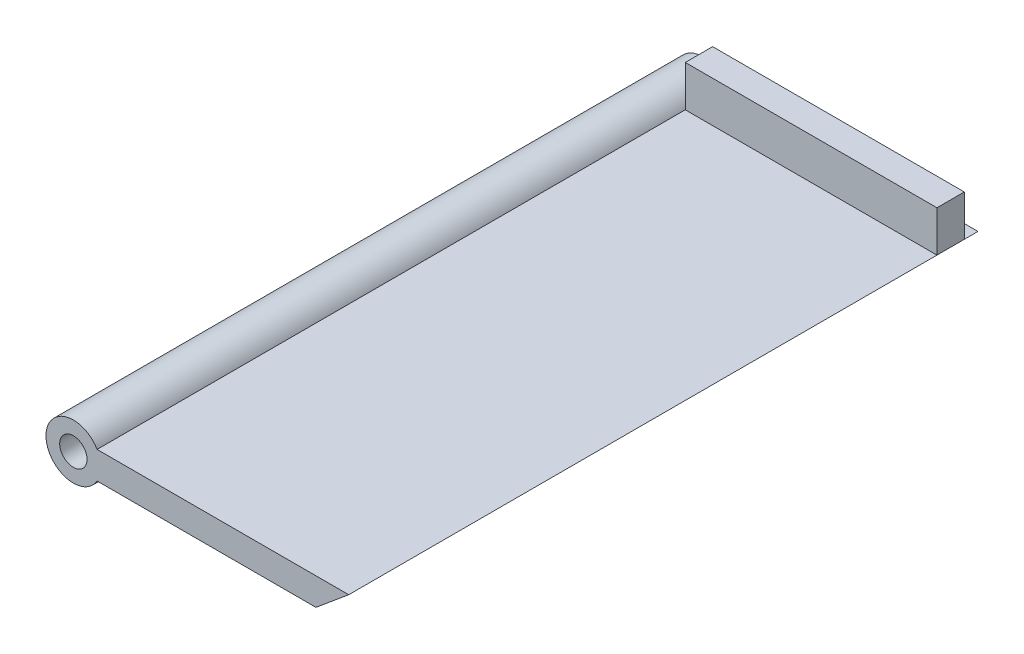
from build123d import *

# Parameters (mm, degrees)
SKETCH1_R           = 3.175
BOSS_EXTRUDE1_DEPTH = 146.05
BOSS_EXTRUDE2_DEPTH = 3.175
SKETCH3_W           = 58.42
SKETCH3_H           = 9.525
BOSS_EXTRUDE3_DEPTH = 3.175


with BuildPart() as part:
    # Sketch1 → Boss-Extrude1 (new body)
    with BuildSketch(Plane.XY):
        with BuildLine():
            Line((40.420068278, 3.055455197), (32.800068278, -3.294544803))
            Line((32.800068278, -3.294544803), (-17.999931722, -3.294544803))
            ThreePointArc((-17.999931722, -3.294544803), (-29.849193037, -0.119544803), (-17.999931722, 3.055455197))
            Line((-17.999931722, 3.055455197), (40.420068278, 3.055455197))
        make_face()
        with Locations((-23.499193037, -0.119544803)):
            Circle(SKETCH1_R, mode=Mode.SUBTRACT)
    extrude(amount=BOSS_EXTRUDE1_DEPTH)

    # Sketch2 → Boss-Extrude2 (add)
    with BuildSketch(Plane.XY.offset(3.175)):
        Polygon((-17.999931722, 3.055455197), (-14.824931722, 3.055455197), (-14.824931722, 9.405455197), (37.245068278, 9.405455197), (37.245068278, 3.055455197), (40.420068278, 3.055455197), (40.420068278, 12.580455197), (-17.999931722, 12.580455197), align=None)
    extrude(amount=BOSS_EXTRUDE2_DEPTH)

    # Sketch3 → Boss-Extrude3 (add)
    with BuildSketch(Plane.XY.offset(6.35)):
        with Locations((11.210068278, 7.817955197)):
            Rectangle(SKETCH3_W, SKETCH3_H)
    extrude(amount=BOSS_EXTRUDE3_DEPTH)


solid = part.part
